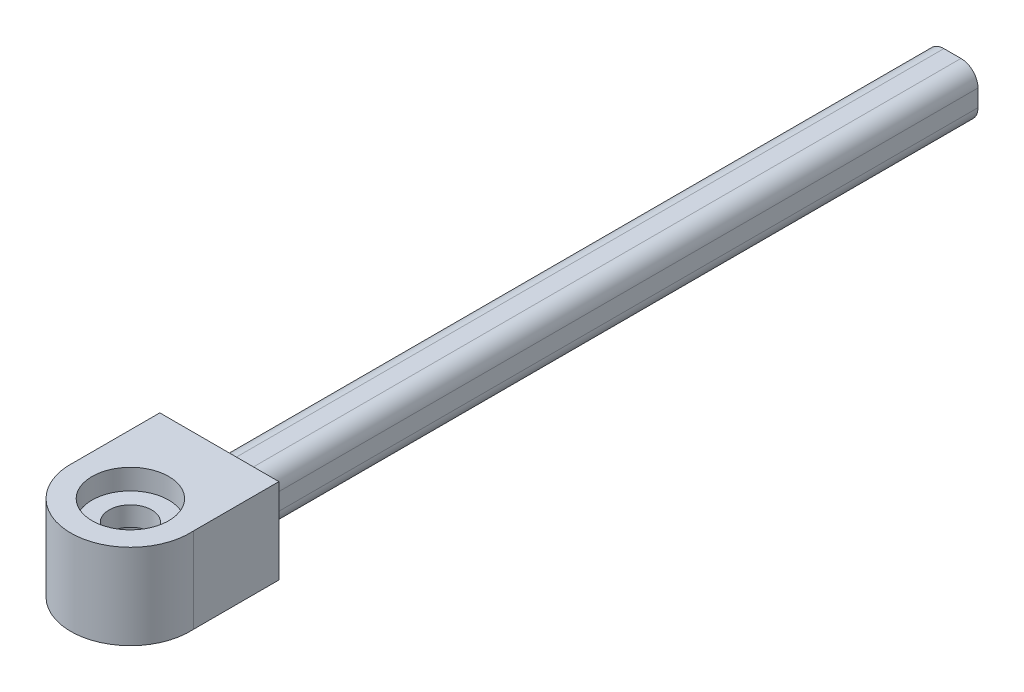
from build123d import *

# Parameters (mm, degrees)
EXTRUDE_1_DEPTH = 2
EXTRUDE_START   = -3
EXTRUDE_2_DEPTH = 3
SKETCH_4_W      = 3
SKETCH_4_H      = 3
EXTRUDE_3_DEPTH = 40
SKETCH_6_W      = 3
SKETCH_6_H      = 3
EXTRUDE_4_DEPTH = 3
FILLET_1_R      = 1


with BuildPart() as part:
    # 草图1 → 旋转1 (revolve)
    with BuildSketch(Plane.XY, mode=Mode.PRIVATE) as revolve_1_sk:
        Polygon((-2.4, 0), (-3.5, 0), (-3.5, 5), (-2.25, 5), (-2.25, 3.8), (-1.25, 3.8), (-1.25, 2.66), (-2.4, 2.66), align=None)
    revolve(revolve_1_sk.sketch.rotate(Axis((0, 0, 0), (0, 1, 0)), 270), axis=Axis((0, 0, 0), (0, 1, 0)))

    # 草图2 → 凸台-拉伸1 (add)
    with BuildSketch(Plane(origin=(0, 2, 0), x_dir=(-1, 0, 0), z_dir=(0, -1, 0))):
        with BuildLine():
            Line((-3.493157374, 0.21875), (-3.493157374, 5.21875))
            Line((-3.493157374, 5.21875), (3.493157374, 5.21875))
            Line((3.493157374, 5.21875), (3.493157374, 0.21875))
            ThreePointArc((3.493157374, 0.21875), (0, 3.5), (-3.493157374, 0.21875))
        make_face()
    extrude(amount=EXTRUDE_1_DEPTH)

    # 草图2<2> → 凸台-拉伸2 (add)
    with BuildSketch(Plane(origin=(0, 2, 0), x_dir=(-1, 0, 0), z_dir=(0, -1, 0)).offset(EXTRUDE_START)):
        with BuildLine():
            Line((-3.493157374, 0.21875), (-3.493157374, 5.21875))
            Line((-3.493157374, 5.21875), (3.493157374, 5.21875))
            Line((3.493157374, 5.21875), (3.493157374, 0.21875))
            ThreePointArc((3.493157374, 0.21875), (0, 3.5), (-3.493157374, 0.21875))
        make_face()
    extrude(amount=EXTRUDE_2_DEPTH)

    # 草图4 → 凸台-拉伸3 (add)
    with BuildSketch(Plane(origin=(0, 0, -5.21875), x_dir=(-1, 0, 0), z_dir=(0, 0, -1))):
        with Locations((0, 2)):
            Rectangle(SKETCH_4_W, SKETCH_4_H)
    extrude(amount=EXTRUDE_3_DEPTH)

    # 草图6 → 凸台-拉伸4 (add)
    with BuildSketch(Plane(origin=(0, 0, -45.21875), x_dir=(-1, 0, 0), z_dir=(0, 0, -1))):
        with Locations((0, 2)):
            Rectangle(SKETCH_6_W, SKETCH_6_H)
    extrude(amount=EXTRUDE_4_DEPTH)

    # 圆角1
    fillet_1_edges = [part.edges().sort_by_distance(p)[0] for p in [
        (-1.5, 0.5, -26.71875),
        (-1.5, 3.5, -26.71875),
        (1.5, 3.5, -26.71875),
        (1.5, 0.5, -26.71875),
    ]]
    fillet(fillet_1_edges, radius=FILLET_1_R)


solid = part.part
